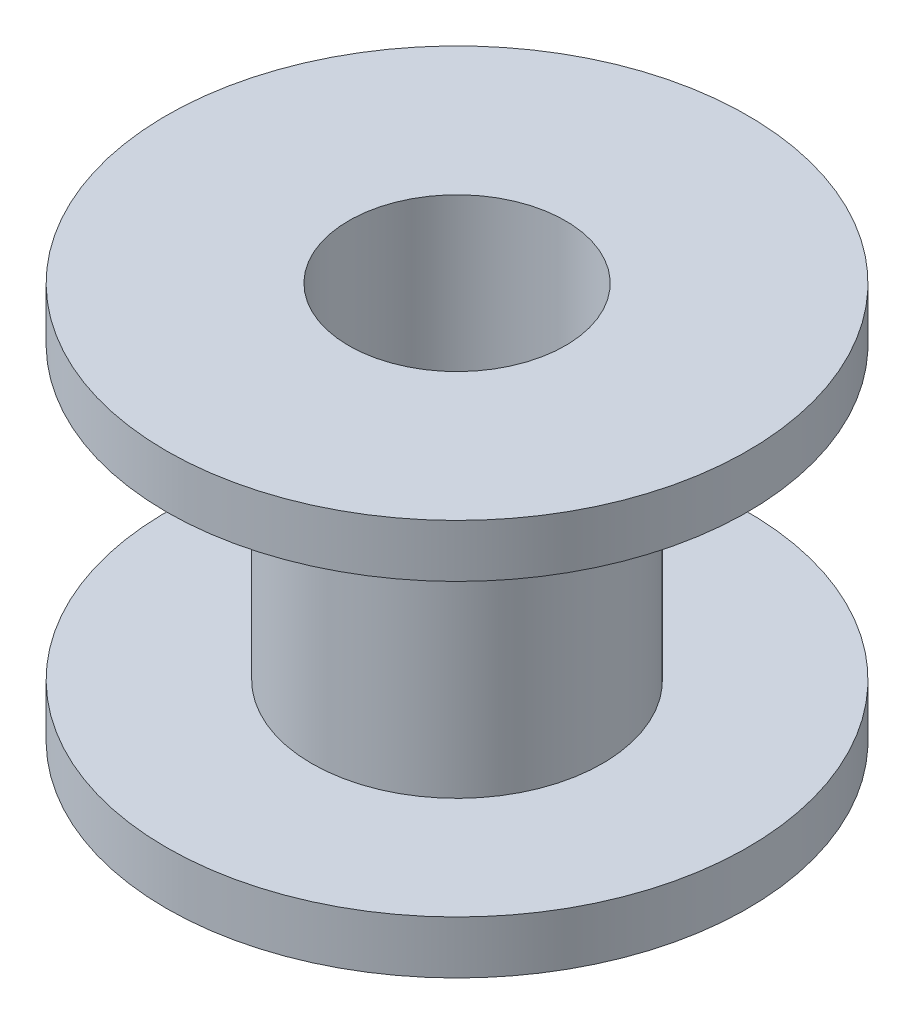
from build123d import *


with BuildPart() as part:
    # Sketch1 → Revolve1 (revolve)
    with BuildSketch(Plane(origin=(0, 0, 0), x_dir=(0, 0, -1), z_dir=(1, 0, 0))):
        Polygon((-5.5, 5.5), (-5.5, -5.5), (-11, -5.5), (-11, -7.5), (-4.1, -7.5), (-4.1, 7.5), (-11, 7.5), (-11, 5.5), align=None)
    revolve(axis=Axis((0, 44.659090909, 0), (0, -1, 0)))


solid = part.part
